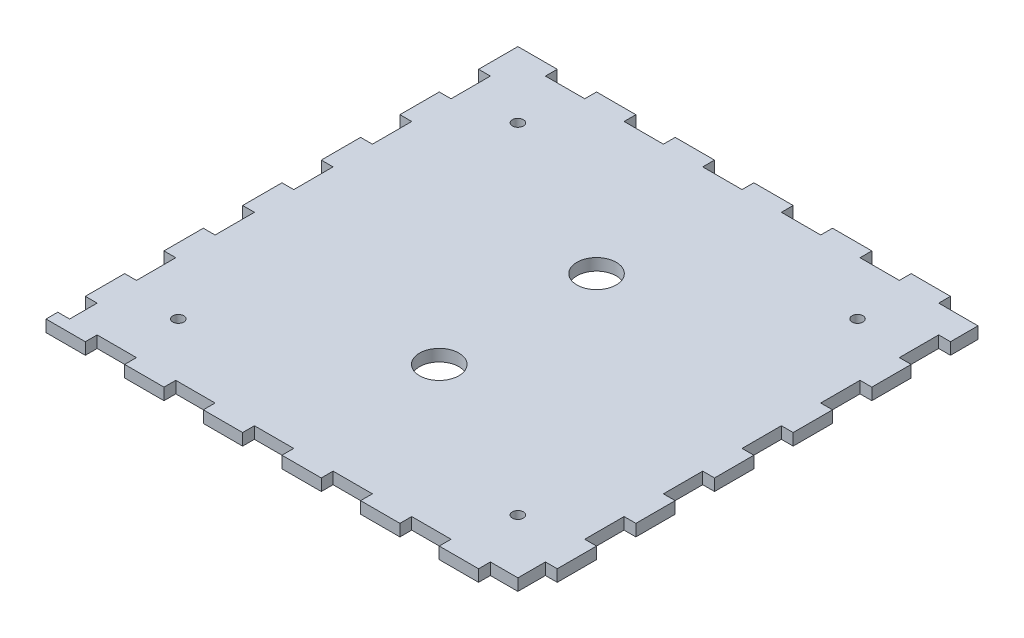
from build123d import *

# Parameters (mm, degrees)
SKETCH1_R           = 1.397
SKETCH1_R_2         = 5
BOSS_EXTRUDE1_DEPTH = 3


with BuildPart() as part:
    # Sketch1 → Boss-Extrude1 (new body)
    with BuildSketch(Plane(origin=(0, 0, 0), x_dir=(1, 0, 0), z_dir=(0, 1, 0))):
        Polygon((-45.181694993, 59.380211874), (-55.181694993, 59.380211874), (-55.181694993, 49.380211874), (-52.181694993, 49.380211874), (-52.181694993, 39.380211874), (-55.181694993, 39.380211874), (-55.181694993, 29.380211874), (-52.181694993, 29.380211874), (-52.181694993, 19.380211874), (-55.181694993, 19.380211874), (-55.181694993, 9.380211874), (-52.181694993, 9.380211874), (-52.181694993, -0.619788126), (-55.181694993, -0.619788126), (-55.181694993, -10.619788126), (-52.181694993, -10.619788126), (-52.181694993, -20.619788126), (-55.181694993, -20.619788126), (-55.181694993, -30.619788126), (-52.181694993, -30.619788126), (-52.181694993, -40.619788126), (-55.181694993, -40.619788126), (-55.181694993, -50.619788126), (-52.181694993, -50.619788126), (-52.181694993, -57.619788126), (-55.181694993, -57.619788126), (-55.181694993, -60.619788126), (-45.181694993, -60.619788126), (-45.181694993, -57.619788126), (-35.181694993, -57.619788126), (-35.181694993, -60.619788126), (-25.181694993, -60.619788126), (-25.181694993, -57.619788126), (-15.181694993, -57.619788126), (-15.181694993, -60.619788126), (-5.181694993, -60.619788126), (-5.181694993, -57.619788126), (4.818305007, -57.619788126), (4.818305007, -60.619788126), (14.818305007, -60.619788126), (14.818305007, -57.619788126), (24.818305007, -57.619788126), (24.818305007, -60.619788126), (34.818305007, -60.619788126), (34.818305007, -57.619788126), (44.818305007, -57.619788126), (44.818305007, -60.619788126), (54.818305007, -60.619788126), (54.818305007, -57.619788126), (61.818305007, -57.619788126), (61.818305007, -50.619788126), (64.818305007, -50.619788126), (64.818305007, -40.619788126), (61.818305007, -40.619788126), (61.818305007, -30.619788126), (64.818305007, -30.619788126), (64.818305007, -20.619788126), (61.818305007, -20.619788126), (61.818305007, -10.619788126), (64.818305007, -10.619788126), (64.818305007, -0.619788126), (61.818305007, -0.619788126), (61.818305007, 9.380211874), (64.818305007, 9.380211874), (64.818305007, 19.380211874), (61.818305007, 19.380211874), (61.818305007, 29.380211874), (64.818305007, 29.380211874), (64.818305007, 39.380211874), (61.818305007, 39.380211874), (61.818305007, 49.380211874), (64.818305007, 49.380211874), (64.818305007, 56.380211874), (54.818305007, 56.380211874), (54.818305007, 59.380211874), (44.818305007, 59.380211874), (44.818305007, 56.380211874), (34.818305007, 56.380211874), (34.818305007, 59.380211874), (24.818305007, 59.380211874), (24.818305007, 56.380211874), (14.818305007, 56.380211874), (14.818305007, 59.380211874), (4.818305007, 59.380211874), (4.818305007, 56.380211874), (-5.181694993, 56.380211874), (-5.181694993, 59.380211874), (-15.181694993, 59.380211874), (-15.181694993, 56.380211874), (-25.181694993, 56.380211874), (-25.181694993, 59.380211874), (-35.181694993, 59.380211874), (-35.181694993, 56.380211874), (-45.181694993, 56.380211874), align=None)
        with Locations(Location((-38.381694993, -43.779788126, 0), (0, 0, 270))):
            Circle(SKETCH1_R, mode=Mode.SUBTRACT)
        with Locations(Location((47.978305007, -43.779788126, 0), (0, 0, 270))):
            Circle(SKETCH1_R, mode=Mode.SUBTRACT)
        with Locations(Location((4.818305007, -20.619788126, 0), (0, 0, 270))):
            Circle(SKETCH1_R_2, mode=Mode.SUBTRACT)
        with Locations(Location((-38.381694993, 42.580211874, 0), (0, 0, 270))):
            Circle(SKETCH1_R, mode=Mode.SUBTRACT)
        with Locations(Location((4.818305007, 19.380211874, 0), (0, 0, 270))):
            Circle(SKETCH1_R_2, mode=Mode.SUBTRACT)
        with Locations(Location((47.978305007, 42.580211874, 0), (0, 0, 270))):
            Circle(SKETCH1_R, mode=Mode.SUBTRACT)
    extrude(amount=BOSS_EXTRUDE1_DEPTH)


solid = part.part
